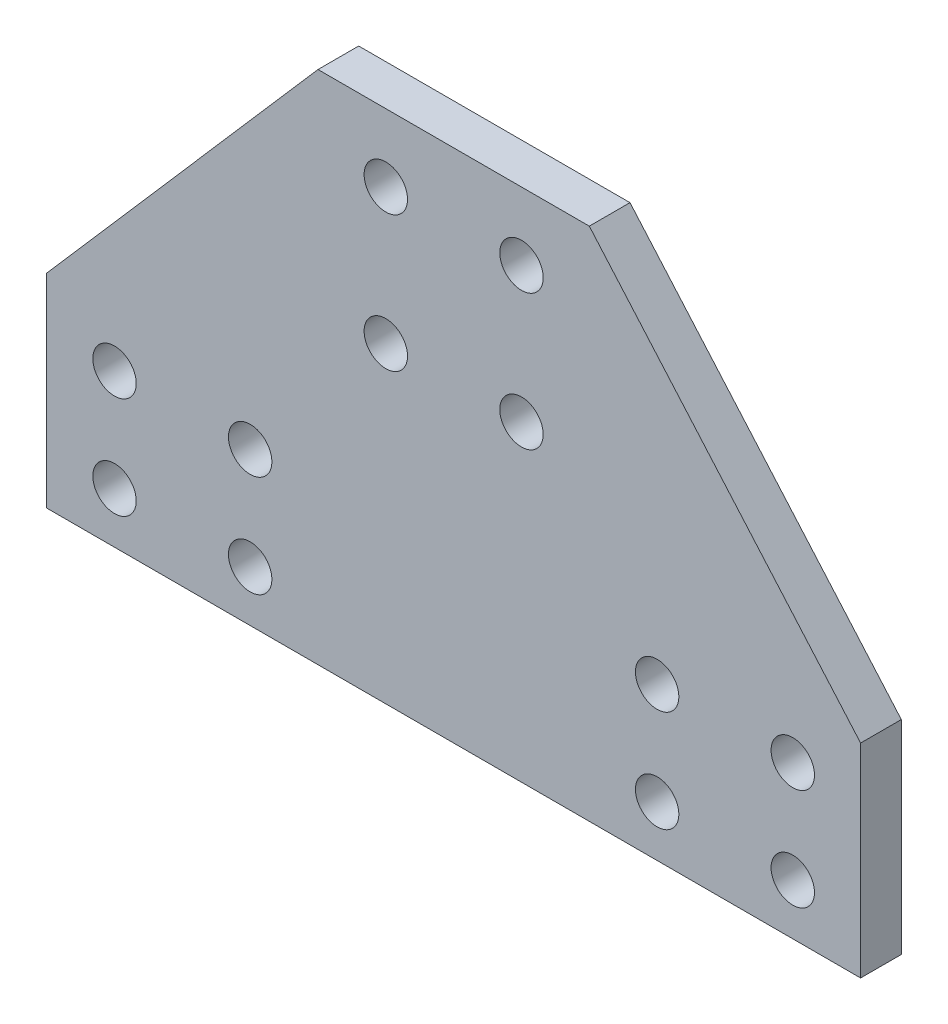
from build123d import *

# Parameters (mm, degrees)
EXTRUDE_1_DEPTH     = 3
SKETCH_2_R          = 1.6
CUT_EXTRUDE_1_DEPTH = 56.253959134


with BuildPart() as part:
    # 草图1 → 凸台-拉伸1 (new body)
    with BuildSketch(Plane.XY):
        Polygon((0, 0), (20, 0), (40, -23), (40, -38), (-20, -38), (-20, -23), align=None)
    extrude(amount=EXTRUDE_1_DEPTH)

    # 草图2 → 切除-拉伸1 (cut, through all)
    with BuildSketch(Plane.XY.offset(3)):
        with Locations((-15, -34.25)):
            Circle(SKETCH_2_R)
        with Locations(Location((-15, -26.75, 0), (0, 0, 180))):
            Circle(SKETCH_2_R)
        with Locations(Location((-5, -34.25, 0), (0, 0, 180))):
            Circle(SKETCH_2_R)
        with Locations((-5, -26.75)):
            Circle(SKETCH_2_R)
        with Locations((25, -34.25)):
            Circle(SKETCH_2_R)
        with Locations(Location((35, -34.25, 0), (0, 0, 180))):
            Circle(SKETCH_2_R)
        with Locations(Location((25, -26.75, 0), (0, 0, 180))):
            Circle(SKETCH_2_R)
        with Locations((35, -26.75)):
            Circle(SKETCH_2_R)
        with Locations((5, -5)):
            Circle(SKETCH_2_R)
        with Locations(Location((15, -5, 0), (0, 0, 180))):
            Circle(SKETCH_2_R)
        with Locations((15, -15)):
            Circle(SKETCH_2_R)
        with Locations(Location((5, -15, 0), (0, 0, 180))):
            Circle(SKETCH_2_R)
    extrude(amount=-CUT_EXTRUDE_1_DEPTH, mode=Mode.SUBTRACT)


solid = part.part
